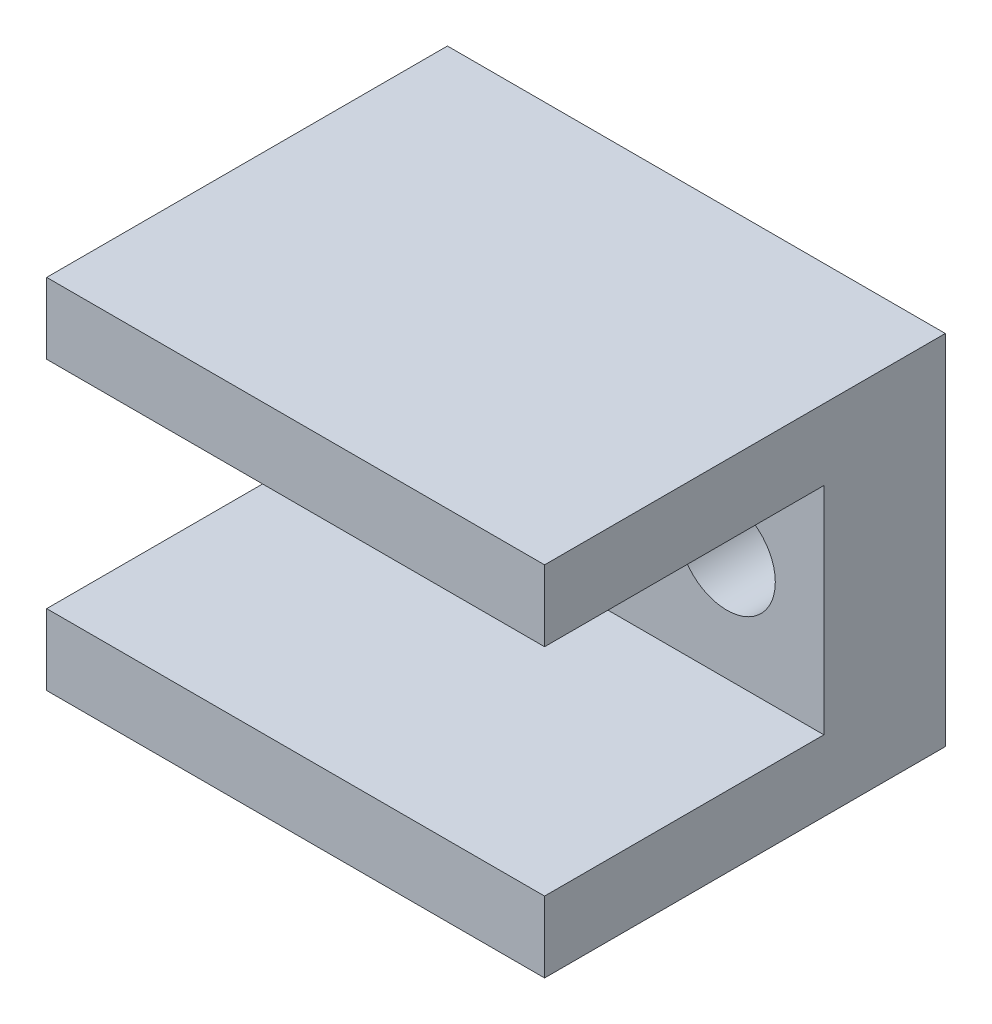
from build123d import *

# Parameters (mm, degrees)
SKETCH1_W           = 41
SKETCH1_H           = 29.464
BOSS_EXTRUDE1_DEPTH = 10
SKETCH2_W           = 41
SKETCH2_H           = 5.842
BOSS_EXTRUDE2_DEPTH = 23
CUT_EXTRUDE1_REACH  = 36.151
SKETCH3_R           = 4


with BuildPart() as part:
    # Sketch1 → Boss-Extrude1 (new body)
    with BuildSketch(Plane.XY):
        Rectangle(SKETCH1_W, SKETCH1_H)
    extrude(amount=BOSS_EXTRUDE1_DEPTH)

    # Sketch2 → Boss-Extrude2 (add)
    with BuildSketch(Plane.XY.offset(10)):
        with Locations((0, 11.811)):
            Rectangle(SKETCH2_W, SKETCH2_H)
        with Locations((0, -11.811)):
            Rectangle(SKETCH2_W, SKETCH2_H)
    extrude(amount=BOSS_EXTRUDE2_DEPTH)

    # Sketch3 → Cut-Extrude1 (cut, up to next)
    with BuildSketch(Plane.XY.offset(10), mode=Mode.PRIVATE) as cut_extrude1_sk1:
        with Locations((-12.5, 0)):
            Circle(SKETCH3_R)
    cut_extrude1_tool1 = extrude(cut_extrude1_sk1.sketch, amount=-CUT_EXTRUDE1_REACH, mode=Mode.PRIVATE) & part.part
    # Sketch3 → Cut-Extrude1 (cut, up to next)
    with BuildSketch(Plane.XY.offset(10), mode=Mode.PRIVATE) as cut_extrude1_sk2:
        with Locations((12.5, 0)):
            Circle(SKETCH3_R)
    cut_extrude1_tool2 = extrude(cut_extrude1_sk2.sketch, amount=-CUT_EXTRUDE1_REACH, mode=Mode.PRIVATE) & part.part
    add(cut_extrude1_tool1.solids().sort_by_distance((-12.5, 0, 10))[0], mode=Mode.SUBTRACT)
    add(cut_extrude1_tool2.solids().sort_by_distance((12.5, 0, 10))[0], mode=Mode.SUBTRACT)


solid = part.part
